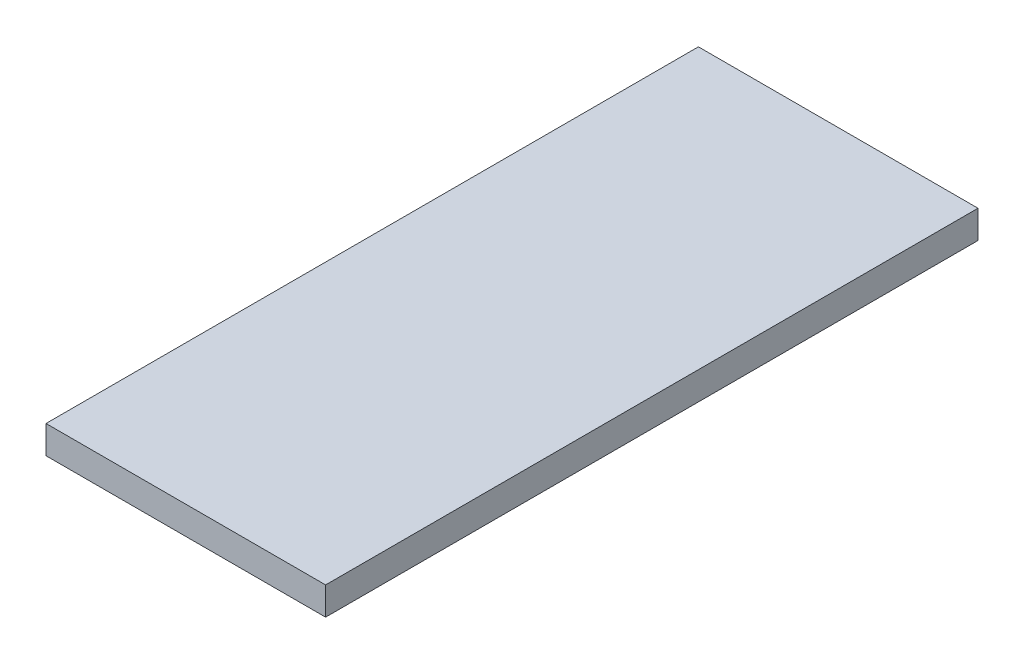
from build123d import *

# Parameters (mm, degrees)
SKETCH_1_W      = 30
SKETCH_1_H      = 70
EXTRUDE_1_DEPTH = 3


with BuildPart() as part:
    # Эскиз1 → Бобышка-Вытянуть1 (new body)
    with BuildSketch(Plane(origin=(0, 0, 0), x_dir=(1, 0, 0), z_dir=(0, 1, 0))):
        Rectangle(SKETCH_1_W, SKETCH_1_H)
    extrude(amount=EXTRUDE_1_DEPTH)


solid = part.part
